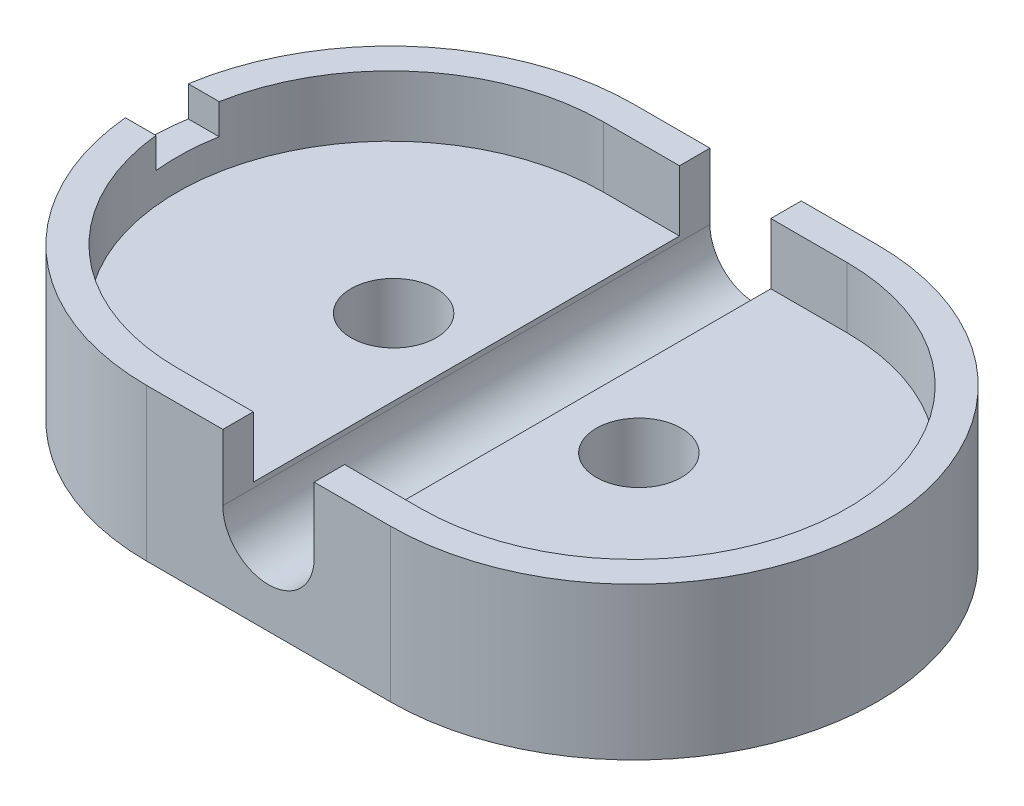
from build123d import *

# Parameters (mm, degrees)
RESSALTO_EXTRUS_O1_DEPTH = 25
CORTE_EXTRUS_O1_DEPTH    = 116.866302263
CORTE_EXTRUS_O2_DEPTH    = 10
CORTE_EXTRUS_O3_DEPTH    = 10
ESBO_O8_W                = 10
ESBO_O8_H                = 5
CORTE_EXTRUS_O4_DEPTH    = 108.61621625
ESBO_O10_R               = 7
CORTE_EXTRUS_O5_DEPTH    = 115.127122105
ESBO_O11_R               = 7
CORTE_EXTRUS_O6_DEPTH    = 115.127122105


with BuildPart() as part:
    # Esboço1 → Ressalto-extrusão1 (new body)
    with BuildSketch(Plane(origin=(0, 0, 0), x_dir=(1, 0, 0), z_dir=(0, 1, 0))):
        with BuildLine():
            Line((0, 0), (40, 0))
            ThreePointArc((40, 0), (80, 40), (40, 80))
            Line((40, 80), (0, 80))
            ThreePointArc((0, 80), (-40, 40), (0, 0))
        make_face()
    extrude(amount=RESSALTO_EXTRUS_O1_DEPTH)

    # Esboço5 → Corte-extrusão1 (cut, through all)
    with BuildSketch(Plane.XY):
        with BuildLine():
            Line((12.5, 25), (12.5, 14.154597668))
            ThreePointArc((12.5, 14.154597668), (20, 6.654597668), (27.5, 14.154597668))
            Line((27.5, 14.154597668), (27.5, 25))
            Line((27.5, 25), (12.5, 25))
        make_face()
    extrude(amount=-CORTE_EXTRUS_O1_DEPTH, mode=Mode.SUBTRACT)

    # Esboço6 → Corte-extrusão2 (cut)
    with BuildSketch(Plane(origin=(0, 25, 0), x_dir=(1, 0, 0), z_dir=(0, 1, 0))):
        with BuildLine():
            Line((12.5, 75), (0, 75))
            ThreePointArc((0, 75), (-35, 40), (0, 5))
            Line((0, 5), (12.5, 5))
            Line((12.5, 5), (12.5, 75))
        make_face()
    extrude(amount=-CORTE_EXTRUS_O2_DEPTH, mode=Mode.SUBTRACT)

    # Esboço7 → Corte-extrusão3 (cut)
    with BuildSketch(Plane(origin=(0, 25, 0), x_dir=(1, 0, 0), z_dir=(0, 1, 0))):
        with BuildLine():
            Line((27.5, 75), (40, 75))
            ThreePointArc((40, 75), (75, 40), (40, 5))
            Line((40, 5), (27.5, 5))
            Line((27.5, 5), (27.5, 75))
        make_face()
    extrude(amount=-CORTE_EXTRUS_O3_DEPTH, mode=Mode.SUBTRACT)

    # Esboço8 → Corte-extrusão4 (cut, through all)
    with BuildSketch(Plane(origin=(12.5, 0, 0), x_dir=(0, 0, -1), z_dir=(1, 0, 0))):
        with Locations((41.323116294, 22.5)):
            Rectangle(ESBO_O8_W, ESBO_O8_H)
    extrude(amount=-CORTE_EXTRUS_O4_DEPTH, mode=Mode.SUBTRACT)

    # Esboço10 → Corte-extrusão5 (cut, through all)
    with BuildSketch(Plane(origin=(0, 15, 0), x_dir=(1, 0, 0), z_dir=(0, 1, 0))):
        with Locations(Location((0, 40.551532556, 0), (0, 0, 270))):
            Circle(ESBO_O10_R)
    extrude(amount=-CORTE_EXTRUS_O5_DEPTH, mode=Mode.SUBTRACT)

    # Esboço11 → Corte-extrusão6 (cut, through all)
    with BuildSketch(Plane(origin=(0, 15, 0), x_dir=(1, 0, 0), z_dir=(0, 1, 0))):
        with Locations(Location((40, 40.827298834, 0), (0, 0, 270))):
            Circle(ESBO_O11_R)
    extrude(amount=-CORTE_EXTRUS_O6_DEPTH, mode=Mode.SUBTRACT)


solid = part.part
